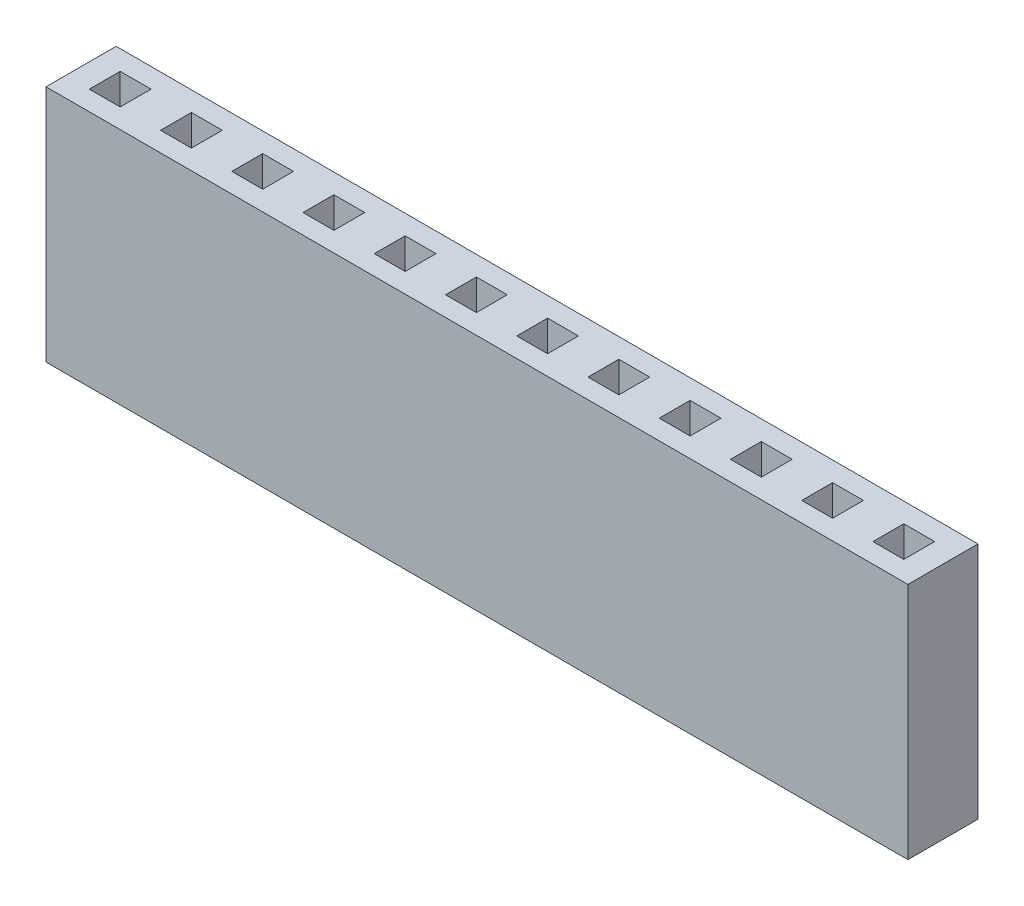
from build123d import *

# Parameters (mm, degrees)
SKETCH1_W           = 30.73
SKETCH1_H           = 8.5
BOSS_EXTRUDE1_DEPTH = 1.25
SKETCH2_W           = 1.1
SKETCH2_H           = 1.1
CUT_EXTRUDE1_DEPTH  = 32.908390746


with BuildPart() as part:
    # Sketch1 → Boss-Extrude1 (new, symmetric)
    with BuildSketch(Plane.XY):
        with Locations((15.365, 4.25)):
            Rectangle(SKETCH1_W, SKETCH1_H)
    extrude(amount=BOSS_EXTRUDE1_DEPTH, both=True)

    # Sketch2 → Cut-Extrude1 (cut, through all)
    with BuildSketch(Plane.XZ):
        with Locations((3.935, 0)):
            Rectangle(SKETCH2_W, SKETCH2_H)
        with Locations((1.395, 0)):
            Rectangle(SKETCH2_W, SKETCH2_H)
        with Locations((6.475, 0)):
            Rectangle(SKETCH2_W, SKETCH2_H)
        with Locations((9.015, 0)):
            Rectangle(SKETCH2_W, SKETCH2_H)
        with Locations((11.555, 0)):
            Rectangle(SKETCH2_W, SKETCH2_H)
        with Locations((14.095, 0)):
            Rectangle(SKETCH2_W, SKETCH2_H)
        with Locations((16.635, 0)):
            Rectangle(SKETCH2_W, SKETCH2_H)
        with Locations((19.175, 0)):
            Rectangle(SKETCH2_W, SKETCH2_H)
        with Locations((21.715, 0)):
            Rectangle(SKETCH2_W, SKETCH2_H)
        with Locations((24.255, 0)):
            Rectangle(SKETCH2_W, SKETCH2_H)
        with Locations((26.795, 0)):
            Rectangle(SKETCH2_W, SKETCH2_H)
        with Locations((29.335, 0)):
            Rectangle(SKETCH2_W, SKETCH2_H)
    extrude(amount=-CUT_EXTRUDE1_DEPTH, mode=Mode.SUBTRACT)


solid = part.part
